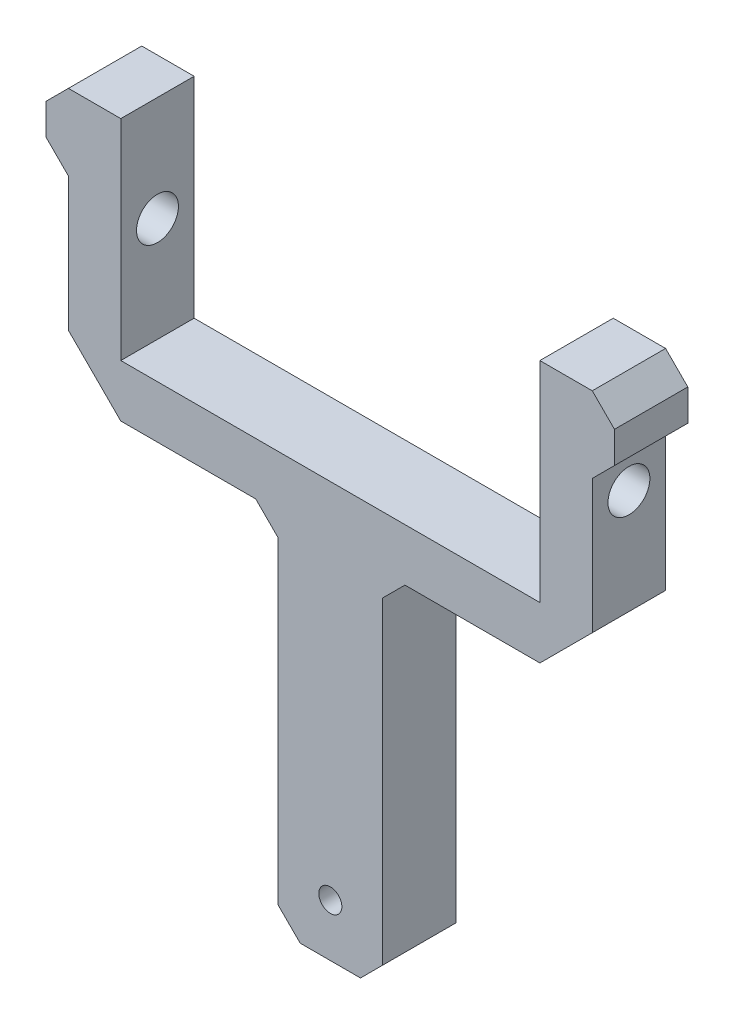
from build123d import *

# Parameters (mm, degrees)
CROQUIS1_R              = 1.1
SALIENTE_EXTRUIR1_DEPTH = 7
CORTAR_EXTRUIR1_DEPTH   = 62.365511626
CROQUIS3_R              = 2
CORTAR_EXTRUIR3_DEPTH   = 76.80759879
CROQUIS4_R              = 3.75
CORTAR_EXTRUIR4_DEPTH   = 76.80759879
CROQUIS5_R              = 3.75
CORTAR_EXTRUIR5_DEPTH   = 76.80759879


with BuildPart() as part:
    # Croquis1 → Saliente-Extruir1 (new body)
    with BuildSketch(Plane.XY):
        Polygon((-5, 27.478679656), (-5, -5), (5, -5), (5, 27.478679656), (7.121320344, 29.6), (20.002640687, 29.6), (25, 34.597359313), (25, 47.357359313), (27.121320344, 49.478679656), (27.121320344, 52.478679656), (25, 54.6), (20, 54.6), (20, 34.6), (-20, 34.6), (-20, 54.6), (-25, 54.6), (-27.121320344, 52.478679656), (-27.121320344, 49.478679656), (-25, 47.357359313), (-25, 34.597359313), (-20.002640687, 29.6), (-7.121320344, 29.6), align=None)
        Circle(CROQUIS1_R, mode=Mode.SUBTRACT)
    extrude(amount=SALIENTE_EXTRUIR1_DEPTH)

    # Croquis2 → Cortar-Extruir1 (cut, through all)
    with BuildSketch(Plane(origin=(0, 0, 0), x_dir=(-1, 0, 0), z_dir=(0, 0, -1))):
        Polygon((-5, -5), (-2.878679656, -5), (-5, -2.878679656), align=None)
        Polygon((2.878679656, -5), (5, -2.878679656), (5, -5), align=None)
    extrude(amount=-CORTAR_EXTRUIR1_DEPTH, mode=Mode.SUBTRACT)

    # Croquis3 → Cortar-Extruir3 (cut, through all)
    with BuildSketch(Plane.ZY.offset(25)):
        with Locations(Location((3.5, 44.597359313, 0), (0, 0, 270))):
            Circle(CROQUIS3_R)
    extrude(amount=-CORTAR_EXTRUIR3_DEPTH, mode=Mode.SUBTRACT)

    # Croquis4 → Cortar-Extruir4 (cut, through all)
    with BuildSketch(Plane.ZY.offset(25)):
        with Locations((3.5, 44.597359313)):
            Circle(CROQUIS4_R)
    extrude(amount=CORTAR_EXTRUIR4_DEPTH, mode=Mode.SUBTRACT)

    # Croquis5 → Cortar-Extruir5 (cut, through all)
    with BuildSketch(Plane(origin=(25, 0, 0), x_dir=(0, 0, -1), z_dir=(1, 0, 0))):
        with Locations((-3.5, 44.597359313)):
            Circle(CROQUIS5_R)
    extrude(amount=CORTAR_EXTRUIR5_DEPTH, mode=Mode.SUBTRACT)


solid = part.part
